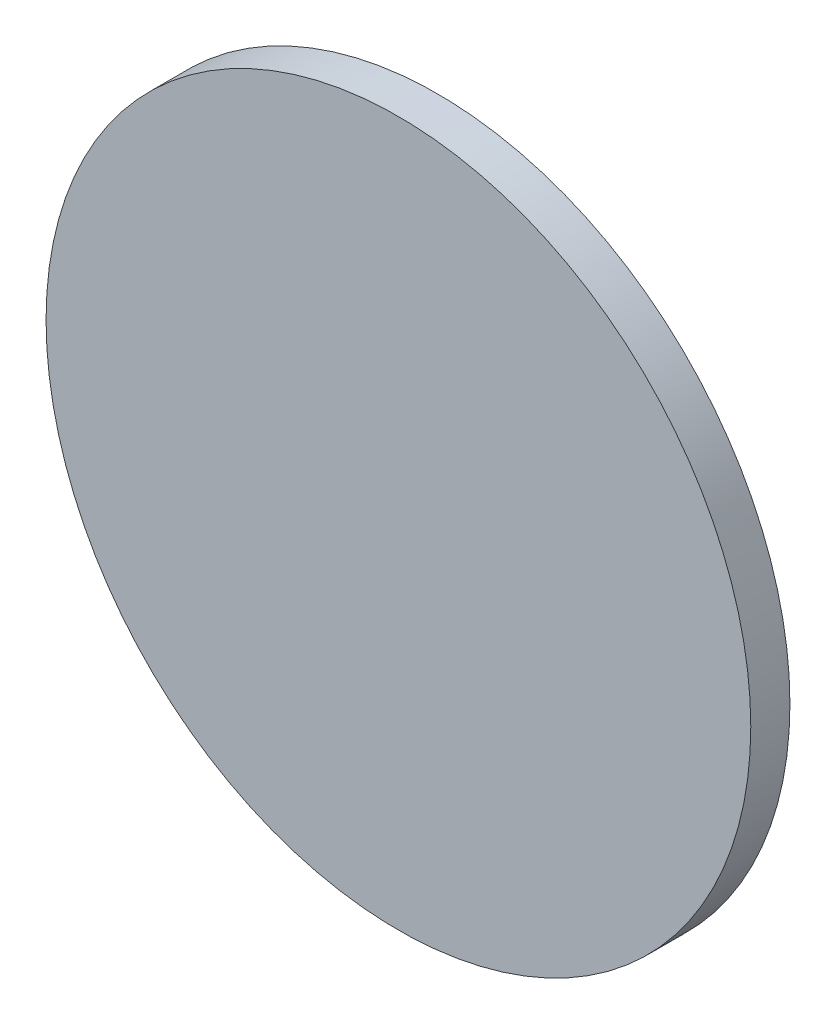
from build123d import *

# Parameters (mm, degrees)
SKETCH1_R      = 114.3
EXTRUDE1_DEPTH = 12.7


with BuildPart() as part:
    # Sketch1 → Extrude1 (new body)
    with BuildSketch(Plane.XY):
        Circle(SKETCH1_R)
    extrude(amount=EXTRUDE1_DEPTH)


solid = part.part
